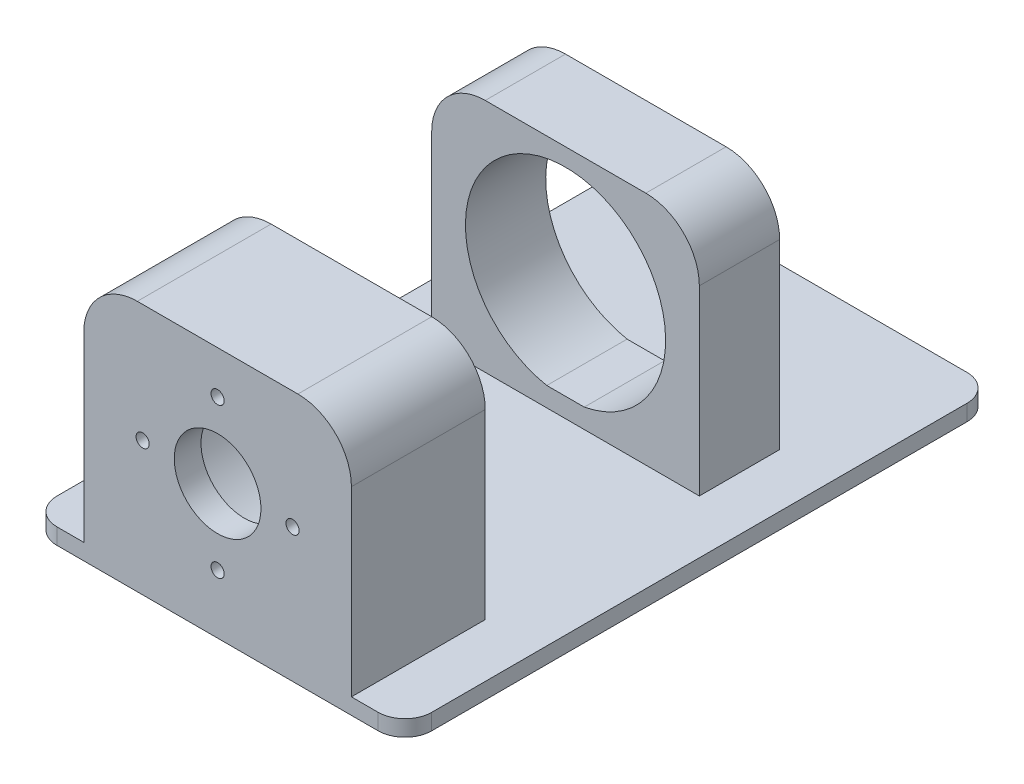
from build123d import *

# Parameters (mm, degrees)
SKETCH1_W           = 50
SKETCH1_H           = 44
SKETCH1_R           = 1.2295
SKETCH1_R_2         = 8.1
BOSS_EXTRUDE1_DEPTH = 5
SKETCH2_W           = 50
SKETCH2_H           = 44
SKETCH2_R           = 18
BOSS_EXTRUDE2_DEPTH = 20
SKETCH4_W           = 70
SKETCH4_H           = 110
BOSS_EXTRUDE3_DEPTH = 3
SKETCH6_W           = 50
SKETCH6_H           = 44
BOSS_EXTRUDE4_DEPTH = 15
FILLET1_R           = 10
FILLET3_R           = 5


with BuildPart() as part:
    # Sketch1 → Boss-Extrude1 (new body)
    with BuildSketch(Plane.XY.offset(45.685001235)):
        with Locations((-11.17428291, 8.97761735)):
            Rectangle(SKETCH1_W, SKETCH1_H)
        with Locations((-11.17428291, 22.97761735)):
            Circle(SKETCH1_R, mode=Mode.SUBTRACT)
        with Locations((2.82571709, 8.97761735)):
            Circle(SKETCH1_R, mode=Mode.SUBTRACT)
        with Locations((-11.17428291, -5.02238265)):
            Circle(SKETCH1_R, mode=Mode.SUBTRACT)
        with Locations((-25.17428291, 8.97761735)):
            Circle(SKETCH1_R, mode=Mode.SUBTRACT)
        with Locations((-11.17428291, 8.97761735)):
            Circle(SKETCH1_R_2, mode=Mode.SUBTRACT)
    extrude(amount=BOSS_EXTRUDE1_DEPTH)

    # Sketch2 → Boss-Extrude2 (add)
    with BuildSketch(Plane(origin=(0, 0, 45.685001235), x_dir=(-1, 0, 0), z_dir=(0, 0, -1))):
        with Locations((11.17428291, 8.97761735)):
            Rectangle(SKETCH2_W, SKETCH2_H)
        with Locations((11.17428291, 8.97761735)):
            Circle(SKETCH2_R, mode=Mode.SUBTRACT)
    extrude(amount=BOSS_EXTRUDE2_DEPTH)

    # Sketch4 → Boss-Extrude3 (add)
    with BuildSketch(Plane.XZ.offset(13.02238265)):
        with Locations((-11.17428291, -4.314998765)):
            Rectangle(SKETCH4_W, SKETCH4_H)
    extrude(amount=BOSS_EXTRUDE3_DEPTH)

    # Sketch6 → Boss-Extrude4 (add)
    with BuildSketch(Plane(origin=(0, 0, -14.314998765), x_dir=(-1, 0, 0), z_dir=(0, 0, -1))):
        with Locations((11.17428291, 8.97761735)):
            Rectangle(SKETCH6_W, SKETCH6_H)
        with BuildLine():
            Line((7.67428291, -9.391922655), (14.67428291, -9.391922655))
            ThreePointArc((14.67428291, -9.391922655), (11.17428291, 27.67761735), (7.67428291, -9.391922655))
        make_face(mode=Mode.SUBTRACT)
    extrude(amount=BOSS_EXTRUDE4_DEPTH)

    # Fillet1
    fillet1_edges = [part.edges().sort_by_distance(p)[0] for p in [
        (13.82571709, 30.97761735, -21.814998765),
        (-36.17428291, 30.97761735, -21.814998765),
        (-36.17428291, 30.97761735, 38.185001235),
        (13.82571709, 30.97761735, 38.185001235),
    ]]
    fillet(fillet1_edges, radius=FILLET1_R)

    # Fillet3
    fillet3_edges = [part.edges().sort_by_distance(p)[0] for p in [
        (23.82571709, -14.52238265, -59.314998765),
        (23.82571709, -14.52238265, 50.685001235),
        (-46.17428291, -14.52238265, 50.685001235),
        (-46.17428291, -14.52238265, -59.314998765),
    ]]
    fillet(fillet3_edges, radius=FILLET3_R)


solid = part.part
